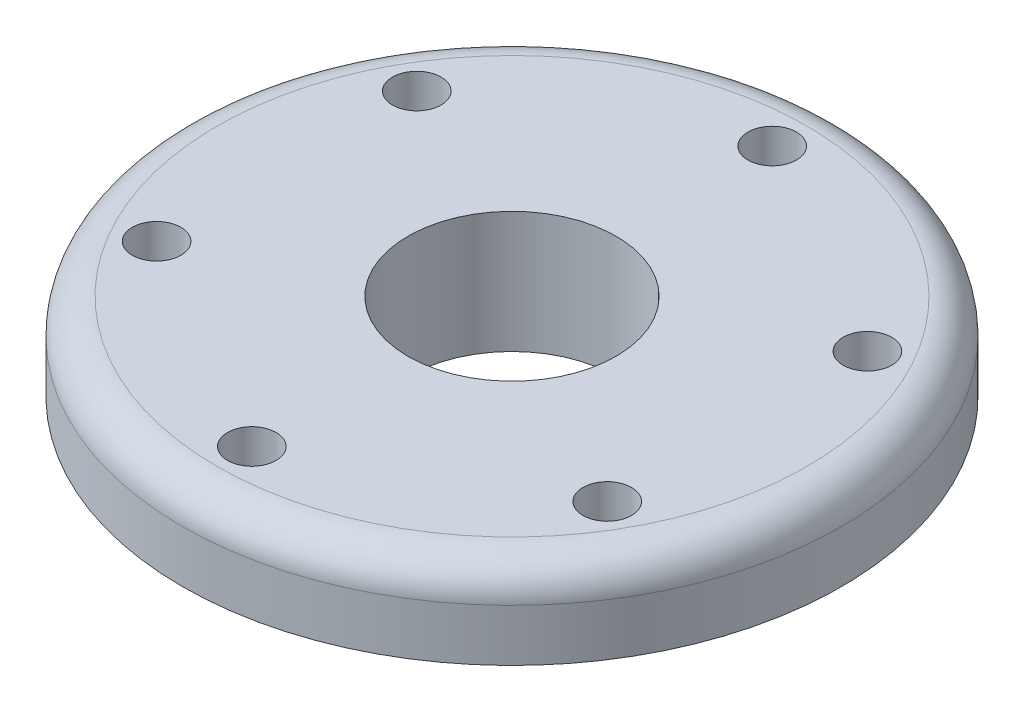
from build123d import *

# Parameters (mm, degrees)
SKETCH1_R           = 12
BOSS_EXTRUDE1_DEPTH = 2
SKETCH2_R           = 19
BOSS_EXTRUDE2_DEPTH = 5
FILLET1_R           = 2
SKETCH3_R           = 6
SKETCH3_R_2         = 1.4
CUT_EXTRUDE1_DEPTH  = 28.766886822


with BuildPart() as part:
    # Sketch1 → Boss-Extrude1 (new body)
    with BuildSketch(Plane(origin=(0, 0, 0), x_dir=(1, 0, 0), z_dir=(0, 1, 0))):
        with Locations(Location((0, 0, 0), (0, 0, 270))):
            Circle(SKETCH1_R)
    extrude(amount=BOSS_EXTRUDE1_DEPTH)

    # Sketch2 → Boss-Extrude2 (add)
    with BuildSketch(Plane(origin=(0, 2, 0), x_dir=(1, 0, 0), z_dir=(0, 1, 0))):
        with Locations(Location((0, 0, 0), (0, 0, 270))):
            Circle(SKETCH2_R)
    extrude(amount=BOSS_EXTRUDE2_DEPTH)

    # Fillet1
    fillet1_edges = [part.edges().sort_by_distance(p)[0] for p in [
        (0, 7, -19),
    ]]
    fillet(fillet1_edges, radius=FILLET1_R)

    # Sketch3 → Cut-Extrude1 (cut, through all)
    with BuildSketch(Plane(origin=(0, 7, 0), x_dir=(1, 0, 0), z_dir=(0, 1, 0))):
        with Locations(Location((0, 0, 0), (0, 0, 270))):
            Circle(SKETCH3_R)
        with Locations(Location((0, 15, 0), (0, 0, 270))):
            Circle(SKETCH3_R_2)
        with Locations(Location((12.990381057, 7.5, 0), (0, 0, 270))):
            Circle(SKETCH3_R_2)
        with Locations(Location((12.990381057, -7.5, 0), (0, 0, 270))):
            Circle(SKETCH3_R_2)
        with Locations(Location((0, -15, 0), (0, 0, 270))):
            Circle(SKETCH3_R_2)
        with Locations(Location((-12.990381057, -7.5, 0), (0, 0, 270))):
            Circle(SKETCH3_R_2)
        with Locations(Location((-12.990381057, 7.5, 0), (0, 0, 270))):
            Circle(SKETCH3_R_2)
    extrude(amount=-CUT_EXTRUDE1_DEPTH, mode=Mode.SUBTRACT)


solid = part.part
